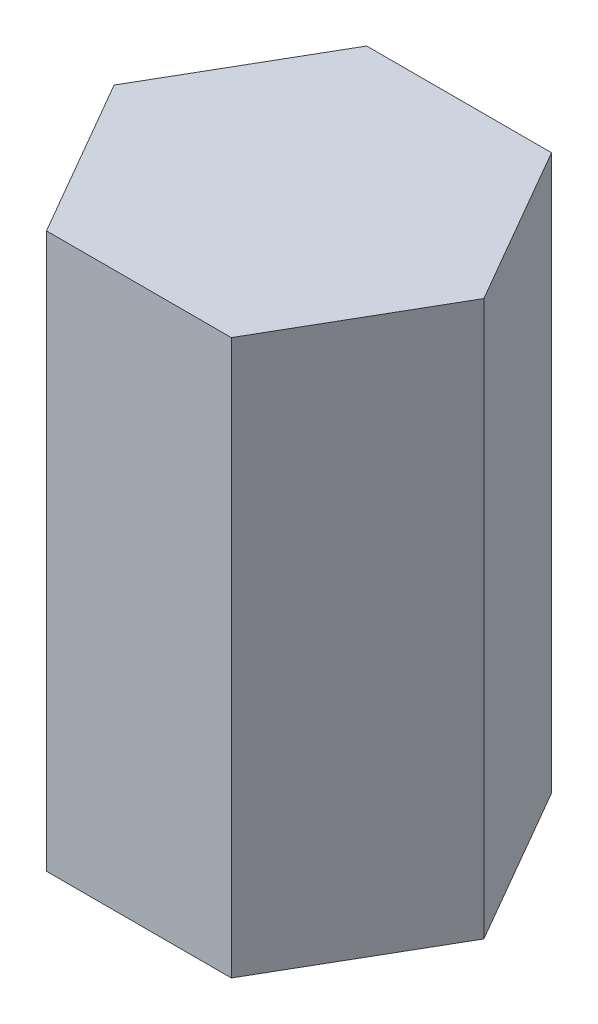
from build123d import *

# Parameters (mm, degrees)
PRISMA_HEXAGONAL_DEPTH     = 120
CROQUIS_AGUJEROS_MONTAJE_R = 4
AGUJERO_INSERTO_M6_DEPTH   = 14


with BuildPart() as part:
    # Croquis_hexagono → Prisma_hexagonal (new body)
    with BuildSketch(Plane(origin=(0, 0, 0), x_dir=(1, 0, 0), z_dir=(0, 1, 0))):
        Polygon((40, 0), (20, 34.641016151), (-20, 34.641016151), (-40, 0), (-20, -34.641016151), (20, -34.641016151), align=None)
    extrude(amount=PRISMA_HEXAGONAL_DEPTH)

    # Croquis_agujeros_montaje → Agujero_inserto_M6 (cut)
    with BuildSketch(Plane(origin=(0, 0, 0), x_dir=(1, 0, 0), z_dir=(0, 1, 0))):
        with Locations(Location((0, 0, 0), (0, 0, 270))):
            Circle(CROQUIS_AGUJEROS_MONTAJE_R)
    extrude(amount=AGUJERO_INSERTO_M6_DEPTH, mode=Mode.SUBTRACT)


solid = part.part
